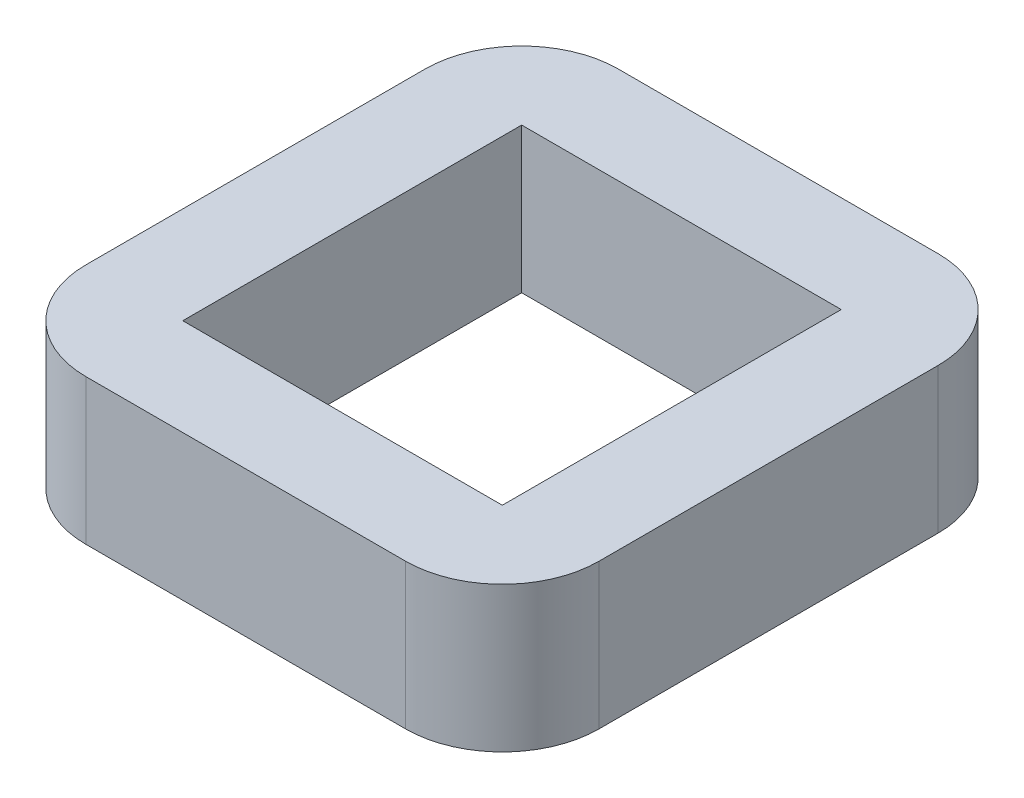
from build123d import *

# Parameters (mm, degrees)
SKETCH_1_W      = 33
SKETCH_1_H      = 35
EXTRUDE_1_DEPTH = 15


with BuildPart() as part:
    # 草圖1 → 填料-伸長1 (new body)
    with BuildSketch(Plane(origin=(0, 0, 0), x_dir=(1, 0, 0), z_dir=(0, 1, 0))):
        with BuildLine():
            Line((16.5, -27.5), (-16.5, -27.5))
            ThreePointArc((-16.5, -27.5), (-23.571067812, -24.571067812), (-26.5, -17.5))
            Line((-26.5, -17.5), (-26.5, 17.5))
            ThreePointArc((-26.5, 17.5), (-23.571067812, 24.571067812), (-16.5, 27.5))
            Line((-16.5, 27.5), (16.5, 27.5))
            ThreePointArc((16.5, 27.5), (23.571067812, 24.571067812), (26.5, 17.5))
            Line((26.5, 17.5), (26.5, -17.5))
            ThreePointArc((26.5, -17.5), (23.571067812, -24.571067812), (16.5, -27.5))
        make_face()
        Rectangle(SKETCH_1_W, SKETCH_1_H, mode=Mode.SUBTRACT)
    extrude(amount=EXTRUDE_1_DEPTH)


solid = part.part
